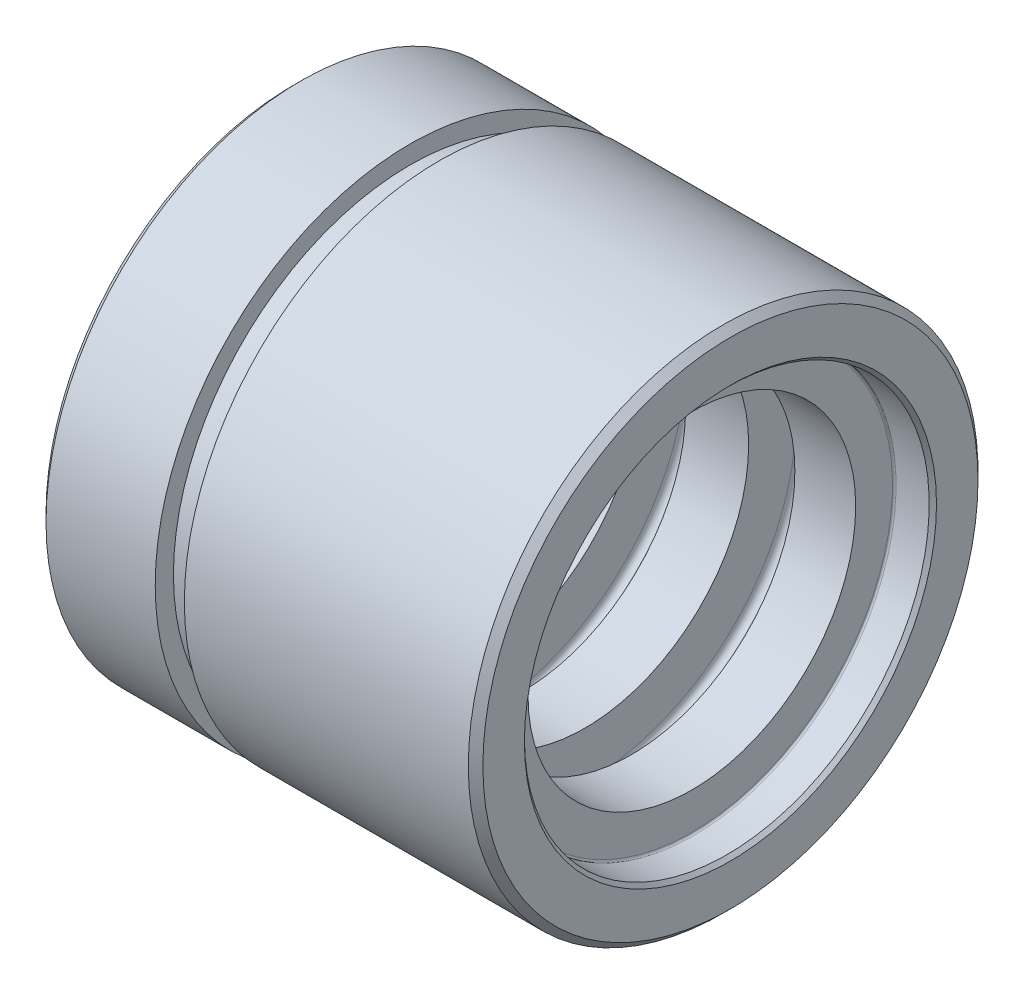
from build123d import *

# Parameters (mm, degrees)
FILLET1_R     = 1
CHAMFER1_SIZE = 0.5
FILLET2_R     = 0.25


with BuildPart() as part:
    # Sketch1 → Revolve1 (revolve)
    with BuildSketch(Plane(origin=(0, 0, 0), x_dir=(1, 0, 0), z_dir=(0, 1, 0)), mode=Mode.PRIVATE) as revolve1_sk:
        Polygon((0, 22.5), (25, 22.5), (25, 30), (31.35, 30), (31.35, 22.5), (40, 22.5), (40, 30), (46.35, 30), (46.35, 22.5), (54.7, 22.5), (54.7, 27.8), (60, 27.8), (60, 34), (59, 35), (20, 35), (20, 32.5), (16, 32.5), (16, 35), (1, 35), (0, 34), align=None)
    revolve(revolve1_sk.sketch.rotate(Axis((-2.239793833, 0, 0), (1, 0, 0)), 180), axis=Axis((-2.239793833, 0, 0), (1, 0, 0)))

    # Fillet1
    fillet1_edges = [part.edges().sort_by_distance(p)[0] for p in [
        (46.35, 0, -30),
        (40, 0, -30),
        (31.35, 0, -30),
        (25, 0, -30),
    ]]
    fillet(fillet1_edges, radius=FILLET1_R)

    # Chamfer1
    chamfer1_edges = [part.edges().sort_by_distance(p)[0] for p in [
        (60, 0, -27.8),
    ]]
    chamfer(chamfer1_edges, length=CHAMFER1_SIZE)

    # Fillet2
    fillet2_edges = [part.edges().sort_by_distance(p)[0] for p in [
        (54.7, 0, -27.8),
    ]]
    fillet(fillet2_edges, radius=FILLET2_R)


solid = part.part
